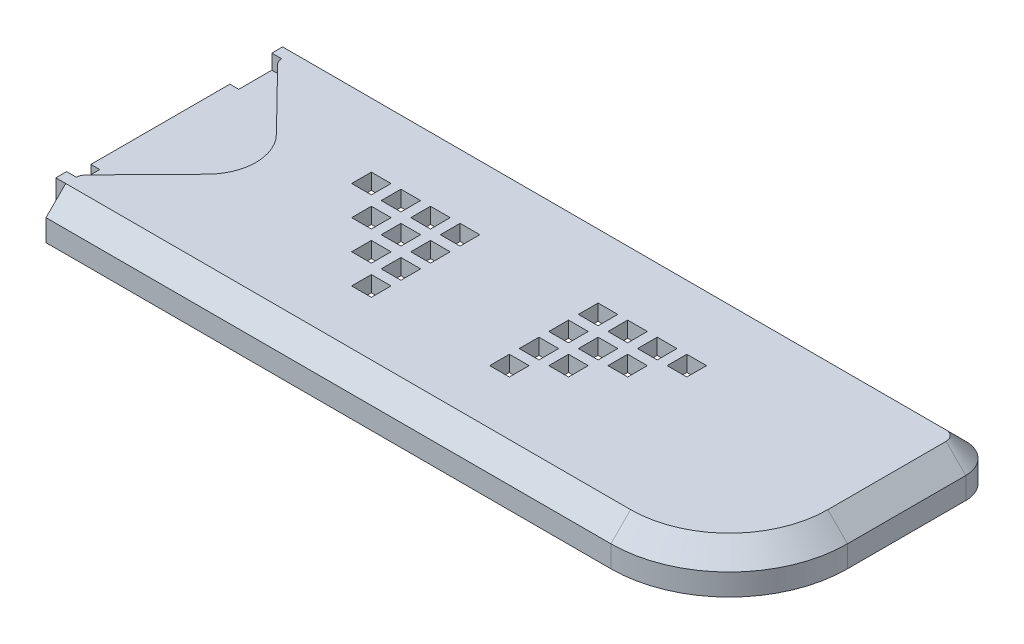
from build123d import *

# Parameters (mm, degrees)
EXTRUDE_1_DEPTH     = 4.2
EXTRUDE_START       = -1.6
EXTRUDE_2_DEPTH     = 1.6
CHAMFER_1_SIZE      = 2
CUT_EXTRUDE_1_DEPTH = 1.5
EXTRUDE_3_DEPTH     = 1.5
SKETCH_5_W          = 2.5
SKETCH_5_H          = 12.1
EXTRUDE_4_DEPTH     = 1.1
SKETCH_6_W          = 2
SKETCH_6_H          = 2
CUT_EXTRUDE_2_DEPTH = 69.191935007


with BuildPart() as part:
    # Эскиз1 → Бобышка-Вытянуть1 (new body)
    with BuildSketch(Plane(origin=(0, 1.5, 0), x_dir=(1, 0, 0), z_dir=(0, 1, 0))):
        with BuildLine():
            Line((46.05, -0.9), (-4.2, -0.9))
            Line((-4.2, -0.9), (-4.2, 1.1))
            Line((-4.2, 1.1), (-5.2, 1.1))
            Line((-5.2, 1.1), (-5.2, 4.95))
            Line((-5.2, 4.95), (-7.7, 4.95))
            Line((-7.7, 4.95), (-7.7, 3.95))
            Line((-7.7, 3.95), (-6.8, 3.95))
            Line((-6.8, 3.95), (-6.8, -0.5))
            Line((-6.8, -0.5), (-5.8, -0.5))
            Line((-5.8, -0.5), (-5.8, -2.5))
            Line((-5.8, -2.5), (46.05, -2.5))
            Line((46.05, -2.5), (50.55, -2.5))
            Line((50.55, -2.5), (51.5, -2.5))
            ThreePointArc((51.5, -2.5), (59.985281374, 1.014718626), (63.5, 9.5))
            Line((63.5, 9.5), (63.5, 21.5))
            ThreePointArc((63.5, 21.5), (62.621320344, 23.621320344), (60.5, 24.5))
            Line((60.5, 24.5), (-5.8, 24.5))
            Line((-5.8, 24.5), (-5.8, 22.5))
            Line((-5.8, 22.5), (-6.8, 22.5))
            Line((-6.8, 22.5), (-6.8, 18.05))
            Line((-6.8, 18.05), (-7.7, 18.05))
            Line((-7.7, 18.05), (-7.7, 17.05))
            Line((-7.7, 17.05), (-5.2, 17.05))
            Line((-5.2, 17.05), (-5.2, 20.9))
            Line((-5.2, 20.9), (-4.2, 20.9))
            Line((-4.2, 20.9), (-4.2, 22.9))
            Line((-4.2, 22.9), (60.5, 22.9))
            ThreePointArc((60.5, 22.9), (61.489949494, 22.489949494), (61.9, 21.5))
            Line((61.9, 21.5), (61.9, 9.5))
            ThreePointArc((61.9, 9.5), (58.853910524, 2.146089476), (51.5, -0.9))
            Line((51.5, -0.9), (50.55, -0.9))
            Line((50.55, -0.9), (46.05, -0.9))
        make_face()
    extrude(amount=EXTRUDE_1_DEPTH)

    # Эскиз2 → Бобышка-Вытянуть2 (add)
    with BuildSketch(Plane(origin=(0, 5.7, 0), x_dir=(1, 0, 0), z_dir=(0, 1, 0)).offset(EXTRUDE_START)):
        with BuildLine():
            Line((-7.7, 17.05), (-7.7, 4.95))
            Line((-7.7, 4.95), (-7.7, 3.95))
            Line((-7.7, 3.95), (-6.8, 3.95))
            Line((-6.8, 3.95), (-6.8, -0.5))
            Line((-6.8, -0.5), (-5.8, -0.5))
            Line((-5.8, -0.5), (-5.8, -2.5))
            Line((-5.8, -2.5), (51.5, -2.5))
            ThreePointArc((51.5, -2.5), (59.985281374, 1.014718626), (63.5, 9.5))
            Line((63.5, 9.5), (63.5, 21.5))
            ThreePointArc((63.5, 21.5), (62.621320344, 23.621320344), (60.5, 24.5))
            Line((60.5, 24.5), (-5.8, 24.5))
            Line((-5.8, 24.5), (-5.8, 22.5))
            Line((-5.8, 22.5), (-6.8, 22.5))
            Line((-6.8, 22.5), (-6.8, 18.05))
            Line((-6.8, 18.05), (-7.7, 18.05))
            Line((-7.7, 18.05), (-7.7, 17.05))
        make_face()
    extrude(amount=EXTRUDE_2_DEPTH)

    # Фаска1
    chamfer_1_edges = [part.edges().sort_by_distance(p)[0] for p in [
        (27.35, 5.7, -24.5),
        (62.621320344, 5.7, -23.621320344),
        (63.5, 5.7, -15.5),
        (59.985281374, 5.7, -1.014718626),
        (22.85, 5.7, 2.5),
    ]]
    chamfer(chamfer_1_edges, length=CHAMFER_1_SIZE)

    # Эскиз3 → Вырез-Вытянуть1 (cut)
    with BuildSketch(Plane(origin=(0, 5.7, 0), x_dir=(1, 0, 0), z_dir=(0, 1, 0))):
        with BuildLine():
            Line((0.570791566, 7.5), (-5.514169361, 1.291627678))
            ThreePointArc((-5.514169361, 1.291627678), (-5.72578868, 0.969696159), (-5.8, 0.591654733))
            Line((-5.8, 0.591654733), (-11.525705964, 0.591654733))
            Line((-11.525705964, 0.591654733), (-11.525705964, 21.408345267))
            Line((-11.525705964, 21.408345267), (-5.8, 21.408345267))
            ThreePointArc((-5.8, 21.408345267), (-5.72578868, 21.030303841), (-5.514169361, 20.708372322))
            Line((-5.514169361, 20.708372322), (0.570791566, 14.5))
            ThreePointArc((0.570791566, 14.5), (2, 11), (0.570791566, 7.5))
        make_face()
    extrude(amount=-CUT_EXTRUDE_1_DEPTH, mode=Mode.SUBTRACT)

    # Эскиз4 → Бобышка-Вытянуть3 (add)
    with BuildSketch(Plane.XZ.offset(-4.1)):
        with BuildLine():
            Line((-4.2, 0.9), (2.224149308, -8.093809031))
            ThreePointArc((2.224149308, -8.093809031), (3.155481952, -11), (2.224149308, -13.906190969))
            Line((2.224149308, -13.906190969), (-4.2, -22.9))
            Line((-4.2, -22.9), (-5.2, -22.9))
            Line((-5.2, -22.9), (-5.2, -17.05))
            Line((-5.2, -17.05), (-7.7, -17.05))
            Line((-7.7, -17.05), (-7.7, -4.95))
            Line((-7.7, -4.95), (-5.998027876, -4.95))
            Line((-5.998027876, -4.95), (-5.2, -1.1))
            Line((-5.2, -1.1), (-4.2, 0.9))
        make_face()
    extrude(amount=EXTRUDE_3_DEPTH)

    # Эскиз5 → Бобышка-Вытянуть4 (add)
    with BuildSketch(Plane.XZ.offset(-2.6)):
        with Locations((-6.45, -11)):
            Rectangle(SKETCH_5_W, SKETCH_5_H)
    extrude(amount=EXTRUDE_4_DEPTH)

    # Эскиз6 → Вырез-Вытянуть2 (cut, through all)
    with BuildSketch(Plane(origin=(0, 5.7, 0), x_dir=(1, 0, 0), z_dir=(0, 1, 0))):
        with Locations((18.7, 15)):
            Rectangle(SKETCH_6_W, SKETCH_6_H)
        with Locations((15.7, 15)):
            Rectangle(SKETCH_6_W, SKETCH_6_H)
        with Locations((12.7, 15)):
            Rectangle(SKETCH_6_W, SKETCH_6_H)
        with Locations((9.7, 15)):
            Rectangle(SKETCH_6_W, SKETCH_6_H)
        with Locations((18.7, 12)):
            Rectangle(SKETCH_6_W, SKETCH_6_H)
        with Locations((15.7, 12)):
            Rectangle(SKETCH_6_W, SKETCH_6_H)
        with Locations((12.7, 12)):
            Rectangle(SKETCH_6_W, SKETCH_6_H)
        with Locations((18.7, 9)):
            Rectangle(SKETCH_6_W, SKETCH_6_H)
        with Locations((15.7, 9)):
            Rectangle(SKETCH_6_W, SKETCH_6_H)
        with Locations((18.7, 6)):
            Rectangle(SKETCH_6_W, SKETCH_6_H)
        with Locations((32.7, 6)):
            Rectangle(SKETCH_6_W, SKETCH_6_H)
        with Locations((35.7, 9)):
            Rectangle(SKETCH_6_W, SKETCH_6_H)
        with Locations((32.7, 9)):
            Rectangle(SKETCH_6_W, SKETCH_6_H)
        with Locations((38.7, 12)):
            Rectangle(SKETCH_6_W, SKETCH_6_H)
        with Locations((35.7, 12)):
            Rectangle(SKETCH_6_W, SKETCH_6_H)
        with Locations((32.7, 12)):
            Rectangle(SKETCH_6_W, SKETCH_6_H)
        with Locations((41.7, 15)):
            Rectangle(SKETCH_6_W, SKETCH_6_H)
        with Locations((38.7, 15)):
            Rectangle(SKETCH_6_W, SKETCH_6_H)
        with Locations((35.7, 15)):
            Rectangle(SKETCH_6_W, SKETCH_6_H)
        with Locations((32.7, 15)):
            Rectangle(SKETCH_6_W, SKETCH_6_H)
    extrude(amount=-CUT_EXTRUDE_2_DEPTH, mode=Mode.SUBTRACT)


solid = part.part
